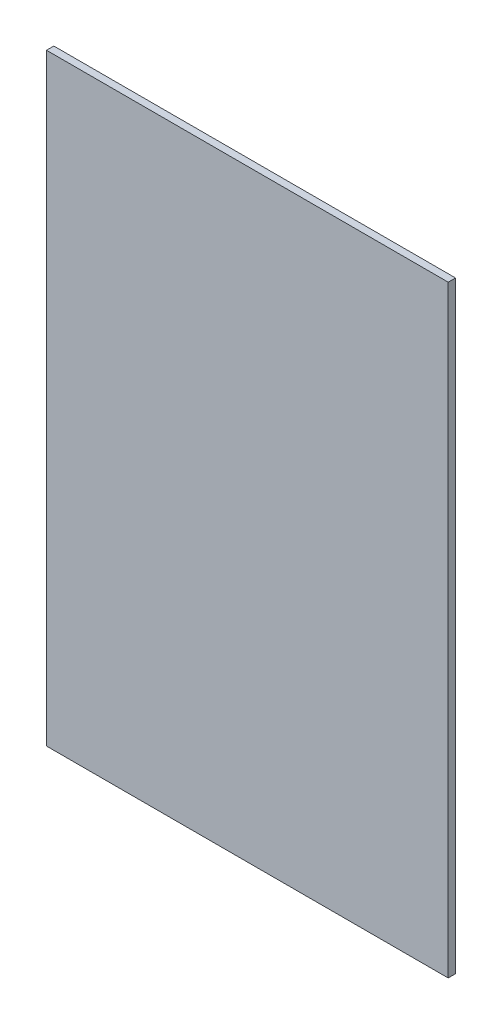
from build123d import *

# Parameters (mm, degrees)
SKETCH1_W           = 609.6
SKETCH1_H           = 914.4
BOSS_EXTRUDE1_DEPTH = 11.1125


with BuildPart() as part:
    # Sketch1 → Boss-Extrude1 (new body)
    with BuildSketch(Plane.XY):
        with Locations((304.8, 457.2)):
            Rectangle(SKETCH1_W, SKETCH1_H)
    extrude(amount=BOSS_EXTRUDE1_DEPTH)


solid = part.part
